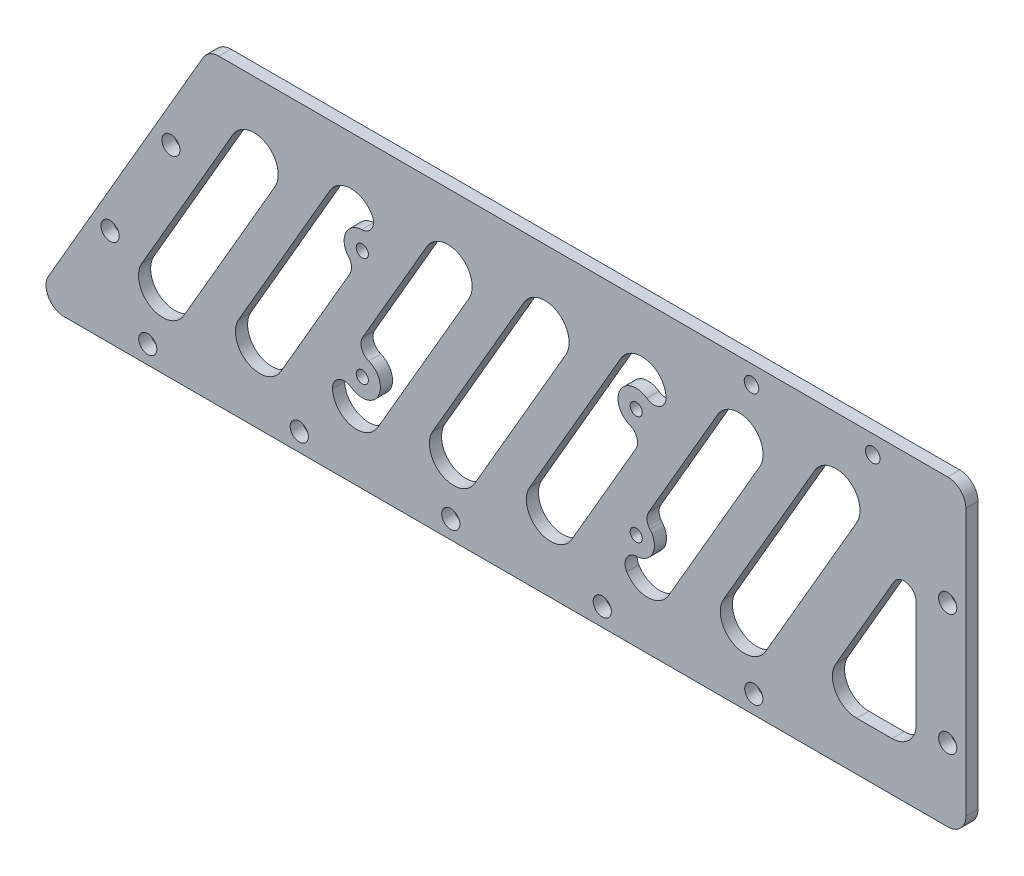
from build123d import *

# Parameters (mm, degrees)
SKETCH_1_W          = 154
SKETCH_1_H          = 50
EXTRUDE_1_DEPTH     = 2
SKETCH_2_R          = 1
CUT_EXTRUDE_1_DEPTH = 10
CUT_EXTRUDE_2_DEPTH = 10
SKETCH_4_R          = 1.5
CUT_EXTRUDE_3_DEPTH = 10
FILLET_1_R          = 3
CUT_EXTRUDE_4_DEPTH = 5
SKETCH_6_R          = 3
SKETCH_6_R_2        = 1
EXTRUDE_2_DEPTH     = 2
FILLET_2_R          = 2
CUT_EXTRUDE_5_DEPTH = 5
FILLET_3_R          = 4
FILLET_4_R          = 2
SKETCH_19_R         = 1.5
CUT_EXTRUDE_6_DEPTH = 10
SKETCH_20_R         = 1.5
CUT_EXTRUDE_7_DEPTH = 81.981479493
SKETCH_22_R         = 1.2
CUT_EXTRUDE_9_DEPTH = 10


with BuildPart() as part:
    # 草图1 → 凸台-拉伸1 (new body)
    with BuildSketch(Plane.XY):
        Rectangle(SKETCH_1_W, SKETCH_1_H)
    extrude(amount=EXTRUDE_1_DEPTH)

    # 草图2 → 切除-拉伸1 (cut)
    with BuildSketch(Plane(origin=(0, 0, 0), x_dir=(-1, 0, 0), z_dir=(0, 0, -1))):
        with Locations((22.6, 9)):
            Circle(SKETCH_2_R)
        with Locations(Location((-22.6, 9, 0), (0, 0, 180))):
            Circle(SKETCH_2_R)
        with Locations(Location((22.6, -9, 0), (0, 0, 180))):
            Circle(SKETCH_2_R)
        with Locations((-22.6, -9)):
            Circle(SKETCH_2_R)
    extrude(amount=-CUT_EXTRUDE_1_DEPTH, mode=Mode.SUBTRACT)

    # 草图3 → 切除-拉伸2 (cut)
    with BuildSketch(Plane.XY.offset(2)):
        Polygon((-77, -25), (-48, 25), (-77, 25), align=None)
    extrude(amount=-CUT_EXTRUDE_2_DEPTH, mode=Mode.SUBTRACT)

    # 草图4 → 切除-拉伸3 (cut)
    with BuildSketch(Plane(origin=(0, 0, 0), x_dir=(-1, 0, 0), z_dir=(0, 0, -1))):
        with Locations((-42, -22)):
            Circle(SKETCH_4_R)
        with Locations((-17, -22)):
            Circle(SKETCH_4_R)
        with Locations((8, -22)):
            Circle(SKETCH_4_R)
        with Locations((33, -22)):
            Circle(SKETCH_4_R)
        with Locations((58, -22)):
            Circle(SKETCH_4_R)
    extrude(amount=-CUT_EXTRUDE_3_DEPTH, mode=Mode.SUBTRACT)

    # 圆角1
    fillet_1_edges = [part.edges().sort_by_distance(p)[0] for p in [
        (-48, 25, 1),
        (77, 25, 1),
        (77, -25, 1),
        (-77, -25, 1),
    ]]
    fillet(fillet_1_edges, radius=FILLET_1_R)

    # 草图5 → 切除-拉伸4 (cut)
    with BuildSketch(Plane(origin=(0, 0, 0), x_dir=(-1, 0, 0), z_dir=(0, 0, -1))):
        with BuildLine():
            Line((4.06564659, -14.982340198), (-10.985896104, 10.96859548))
            ThreePointArc((-10.985896104, 10.96859548), (-9.532643706, 16.435592596), (-4.06564659, 14.982340198))
            Line((-4.06564659, 14.982340198), (10.985896104, -10.96859548))
            ThreePointArc((10.985896104, -10.96859548), (9.532643706, -16.435592596), (4.06564659, -14.982340198))
        make_face()
        with BuildLine():
            Line((20.06564659, -14.982340198), (5.014103896, 10.96859548))
            ThreePointArc((5.014103896, 10.96859548), (6.467356294, 16.435592596), (11.93435341, 14.982340198))
            Line((11.93435341, 14.982340198), (26.985896104, -10.96859548))
            ThreePointArc((26.985896104, -10.96859548), (25.532643706, -16.435592596), (20.06564659, -14.982340198))
        make_face()
        with BuildLine():
            Line((36.06564659, -14.982340198), (21.014103896, 10.96859548))
            ThreePointArc((21.014103896, 10.96859548), (22.467356294, 16.435592596), (27.93435341, 14.982340198))
            Line((27.93435341, 14.982340198), (42.985896104, -10.96859548))
            ThreePointArc((42.985896104, -10.96859548), (41.532643706, -16.435592596), (36.06564659, -14.982340198))
        make_face()
        with BuildLine():
            Line((52.06564659, -14.982340198), (37.014103896, 10.96859548))
            ThreePointArc((37.014103896, 10.96859548), (38.467356294, 16.435592596), (43.93435341, 14.982340198))
            Line((43.93435341, 14.982340198), (58.985896104, -10.96859548))
            ThreePointArc((58.985896104, -10.96859548), (57.532643706, -16.435592596), (52.06564659, -14.982340198))
        make_face()
        with BuildLine():
            Line((-11.93435341, -14.982340198), (-26.985896104, 10.96859548))
            ThreePointArc((-26.985896104, 10.96859548), (-25.532643706, 16.435592596), (-20.06564659, 14.982340198))
            Line((-20.06564659, 14.982340198), (-5.014103896, -10.96859548))
            ThreePointArc((-5.014103896, -10.96859548), (-6.467356294, -16.435592596), (-11.93435341, -14.982340198))
        make_face()
        with BuildLine():
            Line((-27.93435341, -14.982340198), (-42.985896104, 10.96859548))
            ThreePointArc((-42.985896104, 10.96859548), (-41.532643706, 16.435592596), (-36.06564659, 14.982340198))
            Line((-36.06564659, 14.982340198), (-21.014103896, -10.96859548))
            ThreePointArc((-21.014103896, -10.96859548), (-22.467356294, -16.435592596), (-27.93435341, -14.982340198))
        make_face()
        with BuildLine():
            Line((-43.93435341, -14.982340198), (-58.985896104, 10.96859548))
            ThreePointArc((-58.985896104, 10.96859548), (-57.532643706, 16.435592596), (-52.06564659, 14.982340198))
            Line((-52.06564659, 14.982340198), (-37.014103896, -10.96859548))
            ThreePointArc((-37.014103896, -10.96859548), (-38.467356294, -16.435592596), (-43.93435341, -14.982340198))
        make_face()
    extrude(amount=-CUT_EXTRUDE_4_DEPTH, mode=Mode.SUBTRACT)

    # 草图6 → 凸台-拉伸2 (add)
    # profile 1 of 4: a face of its own
    with BuildSketch(Plane(origin=(0, 0, 0), x_dir=(-1, 0, 0), z_dir=(0, 0, -1))):
        with Locations((22.6, 9)):
            Circle(SKETCH_6_R)
        with Locations((22.6, 9)):
            Circle(SKETCH_6_R_2, mode=Mode.SUBTRACT)
    # profile 2 of 4: a face of its own
    with BuildSketch(Plane(origin=(0, 0, 0), x_dir=(-1, 0, 0), z_dir=(0, 0, -1))):
        with Locations((22.6, -9)):
            Circle(SKETCH_6_R)
        with Locations((22.6, -9)):
            Circle(SKETCH_6_R_2, mode=Mode.SUBTRACT)
    # profile 3 of 4: a face of its own
    with BuildSketch(Plane(origin=(0, 0, 0), x_dir=(-1, 0, 0), z_dir=(0, 0, -1))):
        with Locations((-22.6, -9)):
            Circle(SKETCH_6_R)
        with Locations((-22.6, -9)):
            Circle(SKETCH_6_R_2, mode=Mode.SUBTRACT)
    # profile 4 of 4: a face of its own
    with BuildSketch(Plane(origin=(0, 0, 0), x_dir=(-1, 0, 0), z_dir=(0, 0, -1))):
        with Locations((-22.6, 9)):
            Circle(SKETCH_6_R)
        with Locations(Location((-22.6, 9, 0), (0, 0, 180))):
            Circle(SKETCH_6_R_2, mode=Mode.SUBTRACT)
    extrude(amount=-EXTRUDE_2_DEPTH)

    # 圆角2
    fillet_2_edges = [part.edges().sort_by_distance(p)[0] for p in [
        (-20.798153142, 11.398613745, 1),
        (-23.760443426, 6.233527326, 1),
        (-24.495365876, -6.674577845, 1),
        (-25.559633713, -8.509522393, 1),
        (20.798153142, -11.398613745, 1),
        (23.760443426, -6.233527326, 1),
        (24.495365876, 6.674577845, 1),
        (25.559633713, 8.509522393, 1),
    ]]
    fillet(fillet_2_edges, radius=FILLET_2_R)

    # 草图7 → 切除-拉伸5 (cut)
    with BuildSketch(Plane(origin=(0, 0, 0), x_dir=(-1, 0, 0), z_dir=(0, 0, -1))):
        Polygon((-68.8095376, 11.960699007), (-52.026560829, -16.975467839), (-68.8095376, -16.975467839), align=None)
    extrude(amount=-CUT_EXTRUDE_5_DEPTH, mode=Mode.SUBTRACT)

    # 圆角3
    fillet_3_edges = [part.edges().sort_by_distance(p)[0] for p in [
        (52.026560829, -16.975467839, 1),
        (68.8095376, -16.975467839, 1),
    ]]
    fillet(fillet_3_edges, radius=FILLET_3_R)

    # 圆角4
    fillet_4_edges = [part.edges().sort_by_distance(p)[0] for p in [
        (68.8095376, 11.960699007, 1),
    ]]
    fillet(fillet_4_edges, radius=FILLET_4_R)

    # 草图19 → 切除-拉伸6 (cut)
    with BuildSketch(Plane(origin=(0, 0, 0), x_dir=(-1, 0, 0), z_dir=(0, 0, -1))):
        with Locations((-74, -13)):
            Circle(SKETCH_19_R)
        with Locations((-74, 7)):
            Circle(SKETCH_19_R)
    extrude(amount=-CUT_EXTRUDE_6_DEPTH, mode=Mode.SUBTRACT)

    # 草图20 → 切除-拉伸7 (cut, through all)
    with BuildSketch(Plane(origin=(0, 0, 0), x_dir=(-1, 0, 0), z_dir=(0, 0, -1))):
        with Locations((64.219334799, -8.943823867)):
            Circle(SKETCH_20_R)
        with Locations((54.184973003, 8.356799919)):
            Circle(SKETCH_20_R)
    extrude(amount=-CUT_EXTRUDE_7_DEPTH, mode=Mode.SUBTRACT)

    # 草图22 → 切除-拉伸9 (cut)
    with BuildSketch(Plane(origin=(0, 0, 0), x_dir=(-1, 0, 0), z_dir=(0, 0, -1))):
        with Locations((-41.62550176, 22)):
            Circle(SKETCH_22_R)
        with Locations((-61.62550176, 22)):
            Circle(SKETCH_22_R)
    extrude(amount=-CUT_EXTRUDE_9_DEPTH, mode=Mode.SUBTRACT)


solid = part.part
